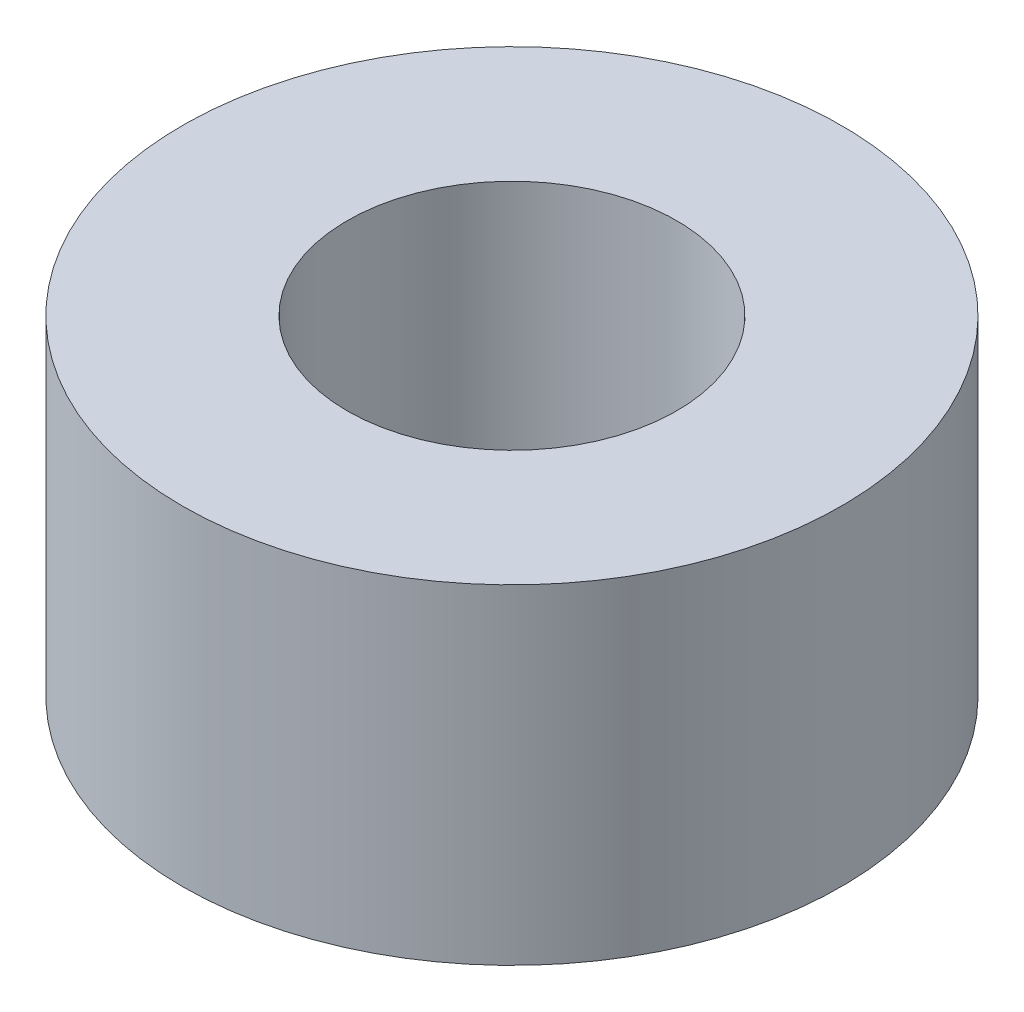
from build123d import *

# Parameters (mm, degrees)
SKETCH_1_R      = 3
SKETCH_1_R_2    = 1.5
EXTRUDE_1_DEPTH = 3


with BuildPart() as part:
    # 草图1 → 凸台-拉伸1 (new body)
    with BuildSketch(Plane(origin=(0, 0, 0), x_dir=(1, 0, 0), z_dir=(0, 1, 0))):
        with Locations(Location((0, 0, 0), (0, 0, 270))):
            Circle(SKETCH_1_R)
        with Locations(Location((0, 0, 0), (0, 0, 270))):
            Circle(SKETCH_1_R_2, mode=Mode.SUBTRACT)
    extrude(amount=EXTRUDE_1_DEPTH)


solid = part.part
